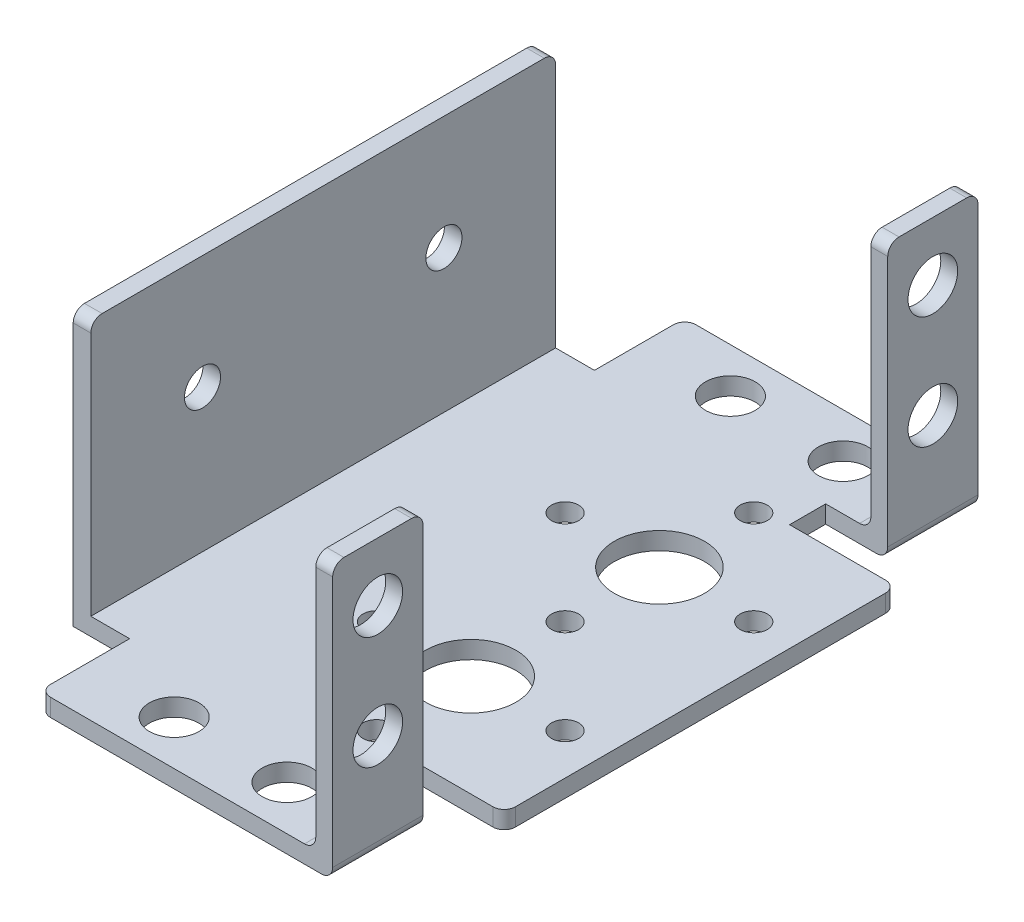
from build123d import *

# Parameters (mm, degrees)
BOSS_EXTRUDE1_DEPTH = 57.2
SKETCH2_R           = 4
SKETCH2_R_2         = 2.2
SKETCH2_R_3         = 1.2
CUT_EXTRUDE1_DEPTH  = 72.325521379
SKETCH3_R           = 1.6
SKETCH3_W           = 8
SKETCH3_H           = 24.3
CUT_EXTRUDE3_DEPTH  = 5
CUT_EXTRUDE4_DEPTH  = 71.809233861
SKETCH5_W           = 1.5
SKETCH5_H           = 8
BOSS_EXTRUDE2_DEPTH = 22.74
FILLET1_R           = 1
SKETCH6_R           = 2.2
CUT_EXTRUDE5_DEPTH  = 5
FILLET2_R           = 1


with BuildPart() as part:
    # Sketch1 → Boss-Extrude1 (new body)
    with BuildSketch(Plane.XY):
        Polygon((0, 24.3), (1.56, 24.3), (1.56, 1.56), (35, 1.56), (35, 0), (0, 0), align=None)
    extrude(amount=-BOSS_EXTRUDE1_DEPTH)

    # Sketch2 → Cut-Extrude1 (cut, through all)
    with BuildSketch(Plane.XZ):
        with Locations(Location((23, -20.24, 0), (0, 0, 270))):
            Circle(SKETCH2_R)
        with Locations(Location((13, -53.25, 0), (0, 0, 180))):
            Circle(SKETCH2_R_2)
        with Locations(Location((23, -28.6, 0), (0, 0, 270))):
            Circle(SKETCH2_R_3)
        with Locations(Location((14.64, -20.24, 0), (0, 0, 270))):
            Circle(SKETCH2_R_3)
        with Locations(Location((23, -11.88, 0), (0, 0, 270))):
            Circle(SKETCH2_R_3)
        with Locations(Location((31.36, -20.24, 0), (0, 0, 270))):
            Circle(SKETCH2_R_3)
        with Locations(Location((23, -53.25, 0), (0, 0, 180))):
            Circle(SKETCH2_R_2)
        with Locations(Location((14.64, -36.96, 0), (0, 0, 180))):
            Circle(SKETCH2_R_3)
        with Locations(Location((31.36, -36.96, 0), (0, 0, 180))):
            Circle(SKETCH2_R_3)
        with Locations(Location((23, -3.95, 0), (0, 0, 270))):
            Circle(SKETCH2_R_2)
        with Locations(Location((23, -45.32, 0), (0, 0, 180))):
            Circle(SKETCH2_R_3)
        with Locations(Location((23, -36.96, 0), (0, 0, 180))):
            Circle(SKETCH2_R)
        with Locations(Location((13, -3.95, 0), (0, 0, 270))):
            Circle(SKETCH2_R_2)
    extrude(amount=-CUT_EXTRUDE1_DEPTH, mode=Mode.SUBTRACT)

    # Sketch3 → Cut-Extrude3 (cut)
    with BuildSketch(Plane.ZY):
        with Locations((-17.9, 14.2)):
            Circle(SKETCH3_R)
        with Locations(Location((-39.3, 14.2, 0), (0, 0, 90))):
            Circle(SKETCH3_R)
        with Locations((-4, 12.15)):
            Rectangle(SKETCH3_W, SKETCH3_H)
        with Locations((-53.2, 12.15)):
            Rectangle(SKETCH3_W, SKETCH3_H)
    extrude(amount=-CUT_EXTRUDE3_DEPTH, mode=Mode.SUBTRACT)

    # Sketch4 → Cut-Extrude4 (cut, through all)
    with BuildSketch(Plane(origin=(0, 1.56, 0), x_dir=(1, 0, 0), z_dir=(0, 1, 0))):
        Polygon((35, 57.2), (31, 57.2), (31, 49.2), (25.5, 49.2), (25.5, 46), (35, 46), align=None)
        Polygon((31, 8), (31, 0), (35, 0), (35, 11.2), (25.5, 11.2), (25.5, 8), align=None)
    extrude(amount=-CUT_EXTRUDE4_DEPTH, mode=Mode.SUBTRACT)

    # Sketch5 → Boss-Extrude2 (add)
    with BuildSketch(Plane(origin=(0, 1.56, 0), x_dir=(1, 0, 0), z_dir=(0, 1, 0))):
        with Locations((30.25, 53.2)):
            Rectangle(SKETCH5_W, SKETCH5_H)
        with Locations((30.25, 4)):
            Rectangle(SKETCH5_W, SKETCH5_H)
    extrude(amount=BOSS_EXTRUDE2_DEPTH)

    # Fillet1
    fillet1_edges = [part.edges().sort_by_distance(p)[0] for p in [
        (31, 0, -53.2),
        (31, 0, -4),
        (29.5, 1.56, -53.2),
        (29.5, 1.56, -4),
    ]]
    fillet(fillet1_edges, radius=FILLET1_R)

    # Sketch6 → Cut-Extrude5 (cut)
    with BuildSketch(Plane(origin=(31, 0, 0), x_dir=(0, 0, -1), z_dir=(1, 0, 0))):
        with Locations((4, 19.1)):
            Circle(SKETCH6_R)
        with Locations((4, 9.1)):
            Circle(SKETCH6_R)
        with Locations((53.2, 9.1)):
            Circle(SKETCH6_R)
        with Locations((53.2, 19.1)):
            Circle(SKETCH6_R)
    extrude(amount=-CUT_EXTRUDE5_DEPTH, mode=Mode.SUBTRACT)

    # Fillet2
    fillet2_edges = [part.edges().sort_by_distance(p)[0] for p in [
        (5, 0.78, -57.2),
        (0.78, 24.3, -49.2),
        (35, 0.78, -46),
        (35, 0.78, -11.2),
        (30.25, 24.3, -57.2),
        (30.25, 24.3, -49.2),
        (30.25, 24.3, -8),
        (30.25, 24.3, 0),
        (5, 0.78, 0),
        (0.78, 24.3, -8),
    ]]
    fillet(fillet2_edges, radius=FILLET2_R)


solid = part.part
